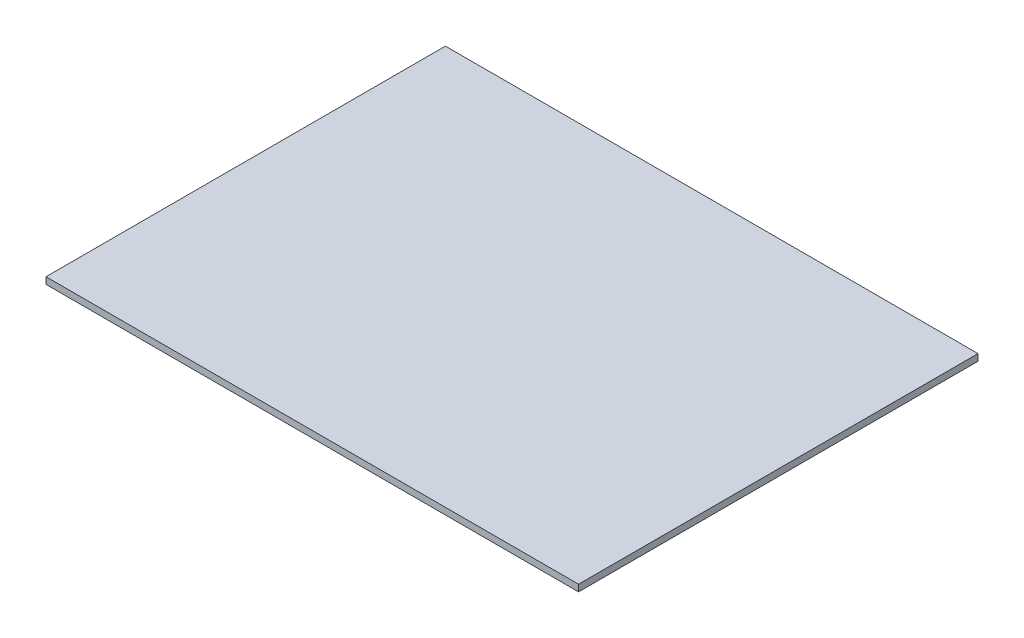
from build123d import *

# Parameters (mm, degrees)
SKETCH1_W           = 254
SKETCH1_H           = 190.5
BOSS_EXTRUDE1_DEPTH = 3.175


with BuildPart() as part:
    # Sketch1 → Boss-Extrude1 (new body)
    with BuildSketch(Plane(origin=(0, 0, 0), x_dir=(1, 0, 0), z_dir=(0, 1, 0))):
        Rectangle(SKETCH1_W, SKETCH1_H)
    extrude(amount=BOSS_EXTRUDE1_DEPTH)


solid = part.part
